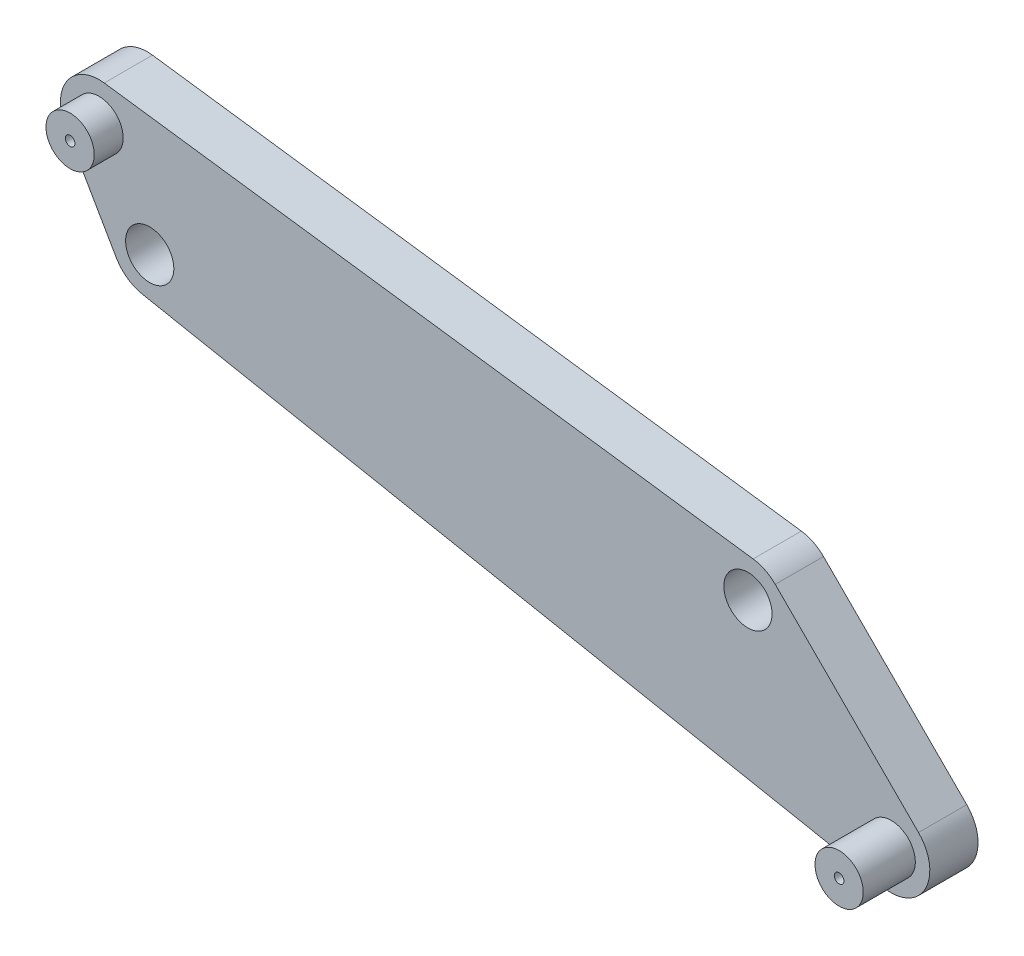
from build123d import *

# Parameters (mm, degrees)
SKETCH2_R           = 2.5
BOSS_EXTRUDE1_DEPTH = 5
SKETCH4_R           = 2.5
SKETCH4_R_2         = 0.5
BOSS_EXTRUDE3_DEPTH = 8
SKETCH5_R           = 2.5
SKETCH5_R_2         = 0.5
BOSS_EXTRUDE4_DEPTH = 2.4


with BuildPart() as part:
    # Sketch2 → Boss-Extrude1 (new body)
    with BuildSketch(Plane.XY):
        with BuildLine():
            Line((-66.71401416, 13.057193982), (0.53598584, 3.963927242))
            ThreePointArc((0.53598584, 3.963927242), (1.775431998, 3.584388542), (2.828427125, 2.828427125))
            Line((2.828427125, 2.828427125), (17.67766953, -12.02081528))
            ThreePointArc((17.67766953, -12.02081528), (18.382077171, -16.725163117), (14.09037667, -18.776598105))
            Line((14.09037667, -18.776598105), (-62.758865735, -3.9273557))
            ThreePointArc((-62.758865735, -3.9273557), (-64.32099942, -3.257754087), (-65.464101615, -2))
            Line((-65.464101615, -2), (-70.714101615, 7.09326674))
            ThreePointArc((-70.714101615, 7.09326674), (-70.571983223, 11.321366258), (-66.71401416, 13.057193982))
        make_face()
        with Locations((-62, 0)):
            Circle(SKETCH2_R, mode=Mode.SUBTRACT)
        with Locations((-67.25, 9.09326674)):
            Circle(SKETCH2_R, mode=Mode.SUBTRACT)
        Circle(SKETCH2_R, mode=Mode.SUBTRACT)
        with Locations((14.849242405, -14.849242405)):
            Circle(SKETCH2_R, mode=Mode.SUBTRACT)
    extrude(amount=BOSS_EXTRUDE1_DEPTH)

    # Sketch4 → Boss-Extrude3 (add)
    # profile 1 of 2: a face of its own
    with BuildSketch(Plane(origin=(0, 0, 0), x_dir=(-1, 0, 0), z_dir=(0, 0, -1))):
        with Locations((67.25, 9.09326674)):
            Circle(SKETCH4_R)
        with Locations((67.25, 9.09326674)):
            Circle(SKETCH4_R_2, mode=Mode.SUBTRACT)
    # profile 2 of 2: a face of its own
    with BuildSketch(Plane(origin=(0, 0, 0), x_dir=(-1, 0, 0), z_dir=(0, 0, -1))):
        with Locations((-14.849242405, -14.849242405)):
            Circle(SKETCH4_R)
        with Locations((-14.849242405, -14.849242405)):
            Circle(SKETCH4_R_2, mode=Mode.SUBTRACT)
    extrude(amount=-BOSS_EXTRUDE3_DEPTH)

    # Sketch5 → Boss-Extrude4 (add)
    with BuildSketch(Plane.XY.offset(8)):
        with Locations((14.849242405, -14.849242405)):
            Circle(SKETCH5_R)
        with Locations(Location((14.849242405, -14.849242405, 0), (0, 0, 180))):
            Circle(SKETCH5_R_2, mode=Mode.SUBTRACT)
    extrude(amount=BOSS_EXTRUDE4_DEPTH)


solid = part.part
